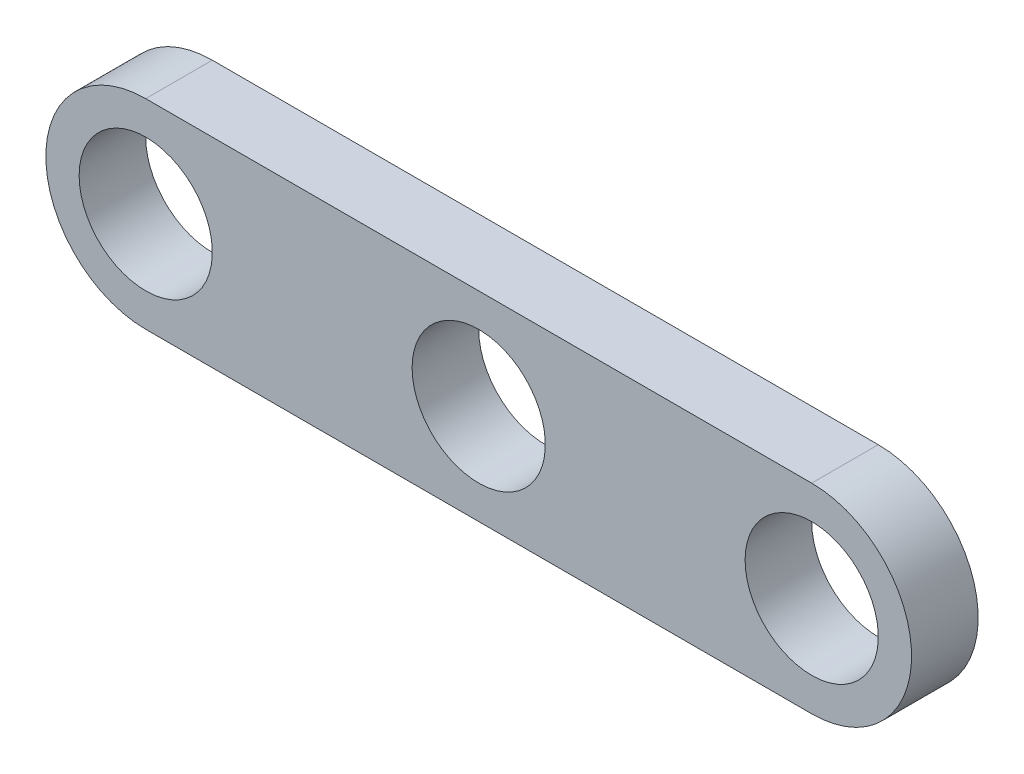
from build123d import *

# Parameters (mm, degrees)
EXTRUDE_2_DEPTH     = 10
SKETCH_2_R          = 10
CUT_EXTRUDE_1_DEPTH = 10
SKETCH_3_R          = 10
CUT_EXTRUDE_2_DEPTH = 10


with BuildPart() as part:
    # Эскиз1 → Бобышка-Вытянуть2 (new body)
    with BuildSketch(Plane.XY):
        with BuildLine():
            Line((0, 0), (-100, 0))
            ThreePointArc((-100, 0), (-115, 15), (-100, 30))
            Line((-100, 30), (0, 30))
            ThreePointArc((0, 30), (15, 15), (0, 0))
        make_face()
    extrude(amount=EXTRUDE_2_DEPTH)

    # Эскиз2 → Вырез-Вытянуть1 (cut)
    with BuildSketch(Plane(origin=(0, 0, 0), x_dir=(-1, 0, 0), z_dir=(0, 0, -1))):
        with Locations((0, 15)):
            Circle(SKETCH_2_R)
        with Locations((100, 15)):
            Circle(SKETCH_2_R)
    extrude(amount=-CUT_EXTRUDE_1_DEPTH, mode=Mode.SUBTRACT)

    # Эскиз3 → Вырез-Вытянуть2 (cut)
    with BuildSketch(Plane(origin=(0, 0, 0), x_dir=(-1, 0, 0), z_dir=(0, 0, -1))):
        with Locations((50, 15)):
            Circle(SKETCH_3_R)
    extrude(amount=-CUT_EXTRUDE_2_DEPTH, mode=Mode.SUBTRACT)


solid = part.part
